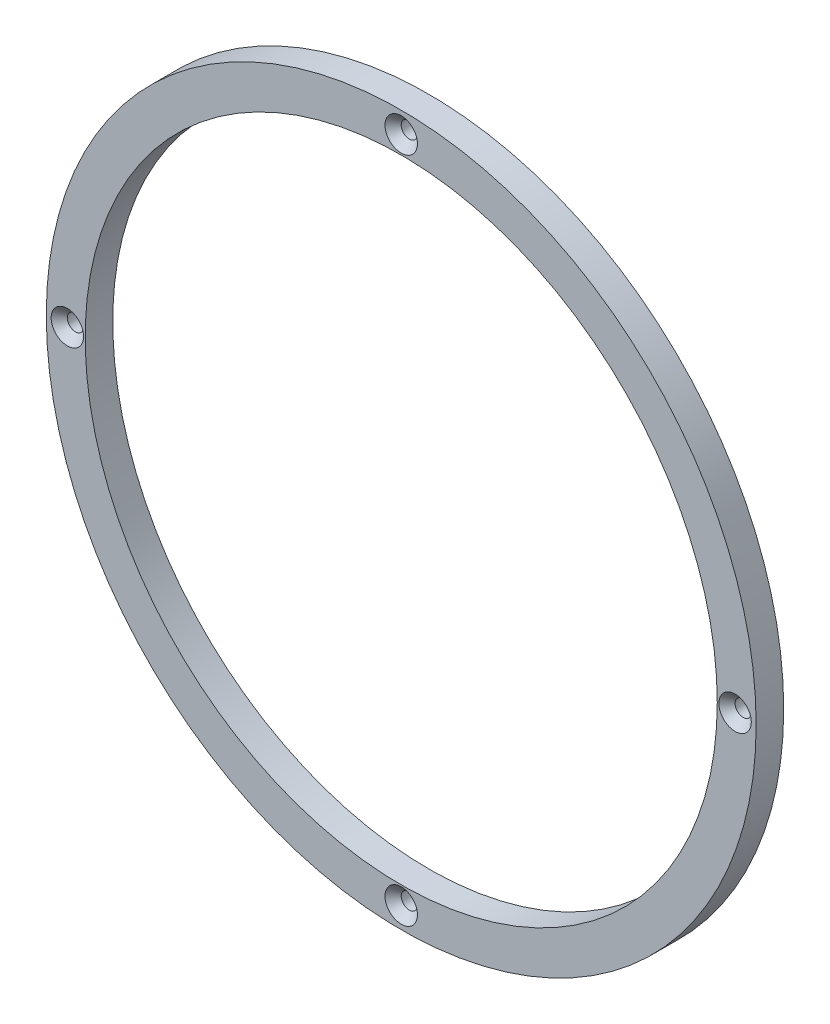
from build123d import *

# Parameters (mm, degrees)
SCHIZZO1_R                                           = 109.5
SCHIZZO1_R_2                                         = 97.5
ESTRUSIONE_ESTRUSIONE1_DEPTH                         = 8.5
FORO_SVASATO_PER_VITE_M4_A_TESTA_SVASATA_D           = 5
FORO_SVASATO_PER_VITE_M4_A_TESTA_SVASATA_CSINK_D     = 10
FORO_SVASATO_PER_VITE_M4_A_TESTA_SVASATA_CSINK_ANGLE = 90
RIPETIZIONECIRCOLARE1_COUNT                          = 4


with BuildPart() as part:
    # Schizzo1 → Estrusione-Estrusione1 (new body)
    with BuildSketch(Plane.XY):
        Circle(SCHIZZO1_R)
        Circle(SCHIZZO1_R_2, mode=Mode.SUBTRACT)
    extrude(amount=ESTRUSIONE_ESTRUSIONE1_DEPTH)

    # Foro svasato per Vite M4 a testa svasata cilindrica1 (through all)
    with Locations(Plane.XY.offset(8.5)):
        with Locations((0, 103)):
            foro_svasato_per_vite_m4_a_testa_svasata = CounterSinkHole(FORO_SVASATO_PER_VITE_M4_A_TESTA_SVASATA_D / 2, FORO_SVASATO_PER_VITE_M4_A_TESTA_SVASATA_CSINK_D / 2, counter_sink_angle=FORO_SVASATO_PER_VITE_M4_A_TESTA_SVASATA_CSINK_ANGLE)

    # RipetizioneCircolare1: Foro svasato per Vite M4 a testa svasata cilindrica1 ×4 about axis
    ripetizionecircolare1_axis = Axis((0, 0, 0), (0, 0, 1))
    for i in range(1, RIPETIZIONECIRCOLARE1_COUNT):
        add(foro_svasato_per_vite_m4_a_testa_svasata.rotate(ripetizionecircolare1_axis, i * 360 / RIPETIZIONECIRCOLARE1_COUNT), mode=Mode.SUBTRACT)


solid = part.part
